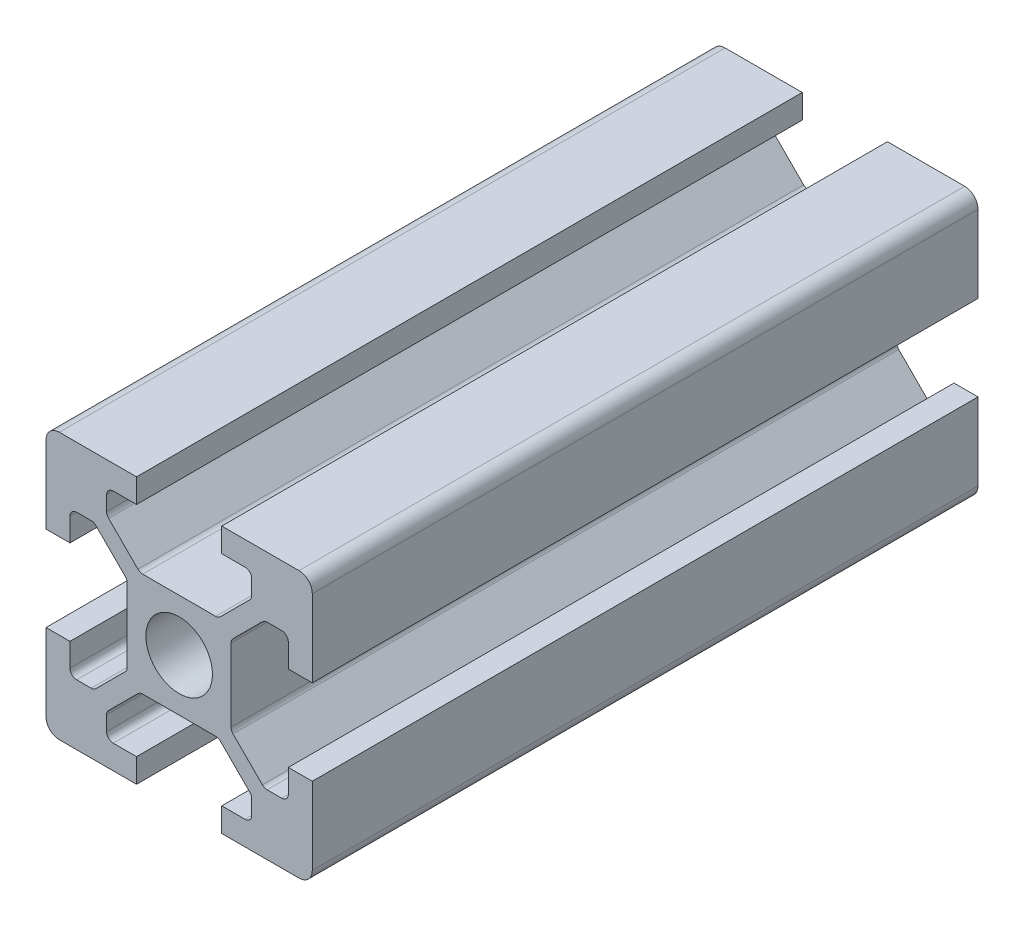
from build123d import *

# Parameters (mm, degrees)
SKETCH1_R           = 2.5
BOSS_EXTRUDE1_DEPTH = 25
FILLET1_R           = 1
FILLET2_R           = 0.5
FILLET3_R           = 0.5
FILLET4_R           = 0.5
FILLET5_R           = 0.5


with BuildPart() as part:
    # Sketch1 → Boss-Extrude1 (new, symmetric)
    with BuildSketch(Plane.XY):
        Polygon((13.2, 0), (13.2, 1.8), (15.45, 1.8), (15.45, 3.6), (12.95, 6.1), (7.05, 6.1), (4.55, 3.6), (4.55, 1.8), (6.8, 1.8), (6.8, 0), (0, 0), (0, 6.8), (1.8, 6.8), (1.8, 4.55), (3.6, 4.55), (6.1, 7.05), (6.1, 12.95), (3.6, 15.45), (1.8, 15.45), (1.8, 13.2), (0, 13.2), (0, 20), (6.8, 20), (6.8, 18.2), (4.55, 18.2), (4.55, 16.4), (7.05, 13.9), (12.95, 13.9), (15.45, 16.4), (15.45, 18.2), (13.2, 18.2), (13.2, 20), (20, 20), (20, 13.2), (18.2, 13.2), (18.2, 15.45), (16.4, 15.45), (13.9, 12.95), (13.9, 7.05), (16.4, 4.55), (18.2, 4.55), (18.2, 6.8), (20, 6.8), (20, 0), align=None)
        with Locations((10, 10)):
            Circle(SKETCH1_R, mode=Mode.SUBTRACT)
    extrude(amount=BOSS_EXTRUDE1_DEPTH, both=True)

    # Fillet1
    fillet1_edges = [part.edges().sort_by_distance(p)[0] for p in [
        (0, 0, 0),
        (0, 20, 0),
        (20, 20, 0),
        (20, 0, 0),
    ]]
    fillet(fillet1_edges, radius=FILLET1_R)

    # Fillet2
    fillet2_edges = [part.edges().sort_by_distance(p)[0] for p in [
        (4.55, 18.2, 0),
        (4.55, 16.4, 0),
        (7.05, 13.9, 0),
        (12.95, 13.9, 0),
        (15.45, 16.4, 0),
        (15.45, 18.2, 0),
    ]]
    fillet(fillet2_edges, radius=FILLET2_R)

    # Fillet3
    fillet3_edges = [part.edges().sort_by_distance(p)[0] for p in [
        (18.2, 15.45, 0),
        (16.4, 15.45, 0),
        (13.9, 12.95, 0),
        (13.9, 7.05, 0),
        (16.4, 4.55, 0),
        (18.2, 4.55, 0),
    ]]
    fillet(fillet3_edges, radius=FILLET3_R)

    # Fillet4
    fillet4_edges = [part.edges().sort_by_distance(p)[0] for p in [
        (1.8, 4.55, 0),
        (3.6, 4.55, 0),
        (6.1, 7.05, 0),
        (6.1, 12.95, 0),
        (3.6, 15.45, 0),
        (1.8, 15.45, 0),
    ]]
    fillet(fillet4_edges, radius=FILLET4_R)

    # Fillet5
    fillet5_edges = [part.edges().sort_by_distance(p)[0] for p in [
        (15.45, 1.8, 0),
        (15.45, 3.6, 0),
        (12.95, 6.1, 0),
        (7.05, 6.1, 0),
        (4.55, 3.6, 0),
        (4.55, 1.8, 0),
    ]]
    fillet(fillet5_edges, radius=FILLET5_R)


solid = part.part
